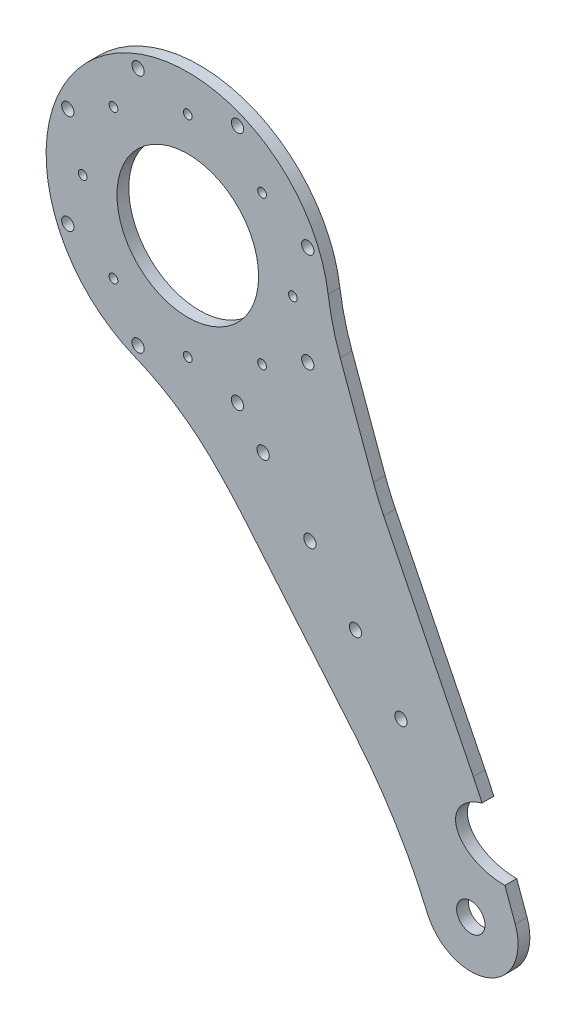
from build123d import *

# Parameters (mm, degrees)
SKETCH_1_R          = 30
SKETCH_1_R_2        = 6
EXTRUDE_1_DEPTH     = 5
SKETCH_2_R          = 1.85
SKETCH_2_R_2        = 1.6
CUT_EXTRUDE_1_DEPTH = 10
SKETCH_3_R          = 2.6
CUT_EXTRUDE_2_DEPTH = 10
FILLET_1_R          = 200
FILLET_2_R          = 200
FILLET_3_R          = 200
FILLET_5_R          = 100
SKETCH_4_R          = 2.6
CUT_EXTRUDE_3_DEPTH = 10
SKETCH_5_RX         = 19.625454407
SKETCH_5_RY         = 13.166615993
CUT_EXTRUDE_4_DEPTH = 10
SKETCH_6_R          = 1.85
SKETCH_6_R_2        = 1.6
EXTRUDE_2_DEPTH     = 5.000001
SKETCH_7_R          = 1.85
CUT_EXTRUDE_5_DEPTH = 10


with BuildPart() as part:
    # 草图1 → 凸台-拉伸1 (new body)
    with BuildSketch(Plane.XY):
        with BuildLine():
            Line((-10.41889066, -59.088465181), (12.562442634, -78.372093471))
            Line((12.562442634, -78.372093471), (92.753346633, -173.939891406))
            Line((92.753346633, -173.939891406), (101.085014518, -196.830960785))
            ThreePointArc((101.085014518, -196.830960785), (126.7192698, -208.784410334), (138.672719349, -183.150155052))
            Line((138.672719349, -183.150155052), (125.846963974, -147.911681773))
            Line((125.846963974, -147.911681773), (80.5212086, -56.381557247))
            Line((80.5212086, -56.381557247), (60, 0))
            ThreePointArc((60, 0), (-38.567256581, 45.962666587), (-10.41889066, -59.088465181))
        make_face()
        Circle(SKETCH_1_R, mode=Mode.SUBTRACT)
        with Locations((119.878866933, -189.990557919)):
            Circle(SKETCH_1_R_2, mode=Mode.SUBTRACT)
    extrude(amount=EXTRUDE_1_DEPTH)

    # 草图2 → 切除-拉伸1 (cut)
    with BuildSketch(Plane.XY.offset(5)):
        with Locations((0, 44.5)):
            Circle(SKETCH_2_R)
        with Locations((31.466251763, 31.466251763)):
            Circle(SKETCH_2_R)
        with Locations((31.466251763, -31.466251763)):
            Circle(SKETCH_2_R)
        with Locations((0, -44.5)):
            Circle(SKETCH_2_R)
        with Locations((-31.466251763, -31.466251763)):
            Circle(SKETCH_2_R)
        with Locations((-31.466251763, 31.466251763)):
            Circle(SKETCH_2_R)
        with Locations((42.5, 0)):
            Circle(SKETCH_2_R_2)
        with Locations((-42.5, 0)):
            Circle(SKETCH_2_R)
    extrude(amount=-CUT_EXTRUDE_1_DEPTH, mode=Mode.SUBTRACT)

    # 草图3 → 切除-拉伸2 (cut)
    with BuildSketch(Plane.XY.offset(5)):
        with Locations((21.04758878, 50.813374288)):
            Circle(SKETCH_3_R)
        with Locations((50.813374288, 21.04758878)):
            Circle(SKETCH_3_R)
        with Locations((50.813374288, -21.04758878)):
            Circle(SKETCH_3_R)
        with Locations((21.04758878, -50.813374288)):
            Circle(SKETCH_3_R)
        with Locations((-21.04758878, -50.813374288)):
            Circle(SKETCH_3_R)
        with Locations((-50.813374288, -21.04758878)):
            Circle(SKETCH_3_R)
        with Locations((-50.813374288, 21.04758878)):
            Circle(SKETCH_3_R)
        with Locations((-21.04758878, 50.813374288)):
            Circle(SKETCH_3_R)
    extrude(amount=-CUT_EXTRUDE_2_DEPTH, mode=Mode.SUBTRACT)

    # 圆角1
    fillet_1_edges = [part.edges().sort_by_distance(p)[0] for p in [
        (125.846963974, -147.911681773, 2.5),
    ]]
    fillet(fillet_1_edges, radius=FILLET_1_R)

    # 圆角2
    fillet_2_edges = [part.edges().sort_by_distance(p)[0] for p in [
        (92.753346633, -173.939891406, 2.5),
    ]]
    fillet(fillet_2_edges, radius=FILLET_2_R)

    # 圆角3
    fillet_3_edges = [part.edges().sort_by_distance(p)[0] for p in [
        (12.562442634, -78.372093471, 2.5),
    ]]
    fillet(fillet_3_edges, radius=FILLET_3_R)

    # 圆角5
    fillet_5_edges = [part.edges().sort_by_distance(p)[0] for p in [
        (80.5212086, -56.381557247, 2.5),
        (60, 0, 2.5),
        (-10.41889066, -59.088465181, 2.5),
    ]]
    fillet(fillet_5_edges, radius=FILLET_5_R)

    # 草图4 → 切除-拉伸3 (cut)
    with BuildSketch(Plane.XY.offset(5)):
        with Locations((31.915052067, -63.622822556)):
            Circle(SKETCH_4_R)
        with Locations((51.725449506, -86.151651937)):
            Circle(SKETCH_4_R)
        with Locations((71.009077797, -109.132985231)):
            Circle(SKETCH_4_R)
        with Locations((90.292706088, -132.114318524)):
            Circle(SKETCH_4_R)
    extrude(amount=-CUT_EXTRUDE_3_DEPTH, mode=Mode.SUBTRACT)

    # 草图5 → 切除-拉伸4 (cut)
    with BuildSketch(Plane.XY.offset(5)):
        with Locations(Location((133.018329516, -157.967583367), (0, 0, -3.070599188))):
            Ellipse(SKETCH_5_RX, SKETCH_5_RY)
    extrude(amount=-CUT_EXTRUDE_4_DEPTH, mode=Mode.SUBTRACT)

    # 草图6 → 凸台-拉伸2 (add, through all)
    with BuildSketch(Plane.XY.offset(5)):
        with Locations((-44.5, 0)):
            Circle(SKETCH_6_R)
        with Locations((-42.5, 0)):
            Circle(SKETCH_6_R)
        with Locations((-44.5, 0)):
            Circle(SKETCH_6_R)
        with Locations((-42.5, 0)):
            Circle(SKETCH_6_R)
        with Locations((42.5, 0)):
            Circle(SKETCH_6_R_2)
        with Locations((44.5, 0)):
            Circle(SKETCH_6_R)
        with Locations((44.5, 0)):
            Circle(SKETCH_6_R)
        with Locations((42.5, 0)):
            Circle(SKETCH_6_R_2)
    extrude(amount=-EXTRUDE_2_DEPTH)

    # 草图7 → 切除-拉伸5 (cut)
    with BuildSketch(Plane.XY.offset(5)):
        with Locations((-44.5, 0)):
            Circle(SKETCH_7_R)
        with Locations((44.5, 0)):
            Circle(SKETCH_7_R)
    extrude(amount=-CUT_EXTRUDE_5_DEPTH, mode=Mode.SUBTRACT)


solid = part.part
